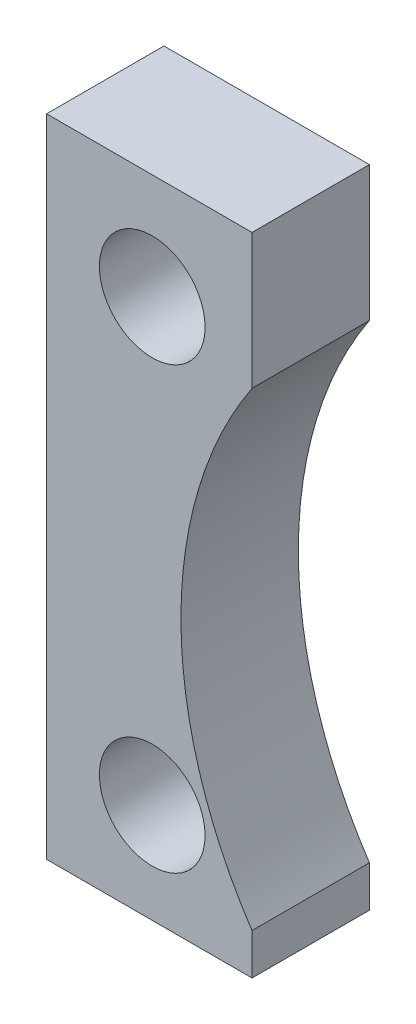
from build123d import *

# Parameters (mm, degrees)
BOSS_EXTRUDE1_DEPTH = 10
SKETCH2_R           = 9
CUT_EXTRUDE1_DEPTH  = 118.153745139


with BuildPart() as part:
    # Sketch1 → Boss-Extrude1 (new, symmetric)
    with BuildSketch(Plane.XY):
        with BuildLine():
            Line((0, 110), (35, 110))
            Line((35, 110), (35, 87))
            ThreePointArc((35, 87), (22.888974491, 47), (35, 7))
            Line((35, 7), (35, 0))
            Line((35, 0), (0, 0))
            Line((0, 0), (0, 110))
        make_face()
    extrude(amount=BOSS_EXTRUDE1_DEPTH, both=True)

    # Sketch2 → Cut-Extrude1 (cut, through all)
    with BuildSketch(Plane.XY.offset(10)):
        with Locations((18, 92)):
            Circle(SKETCH2_R)
        with Locations((18, 17)):
            Circle(SKETCH2_R)
    extrude(amount=-CUT_EXTRUDE1_DEPTH, mode=Mode.SUBTRACT)


solid = part.part
